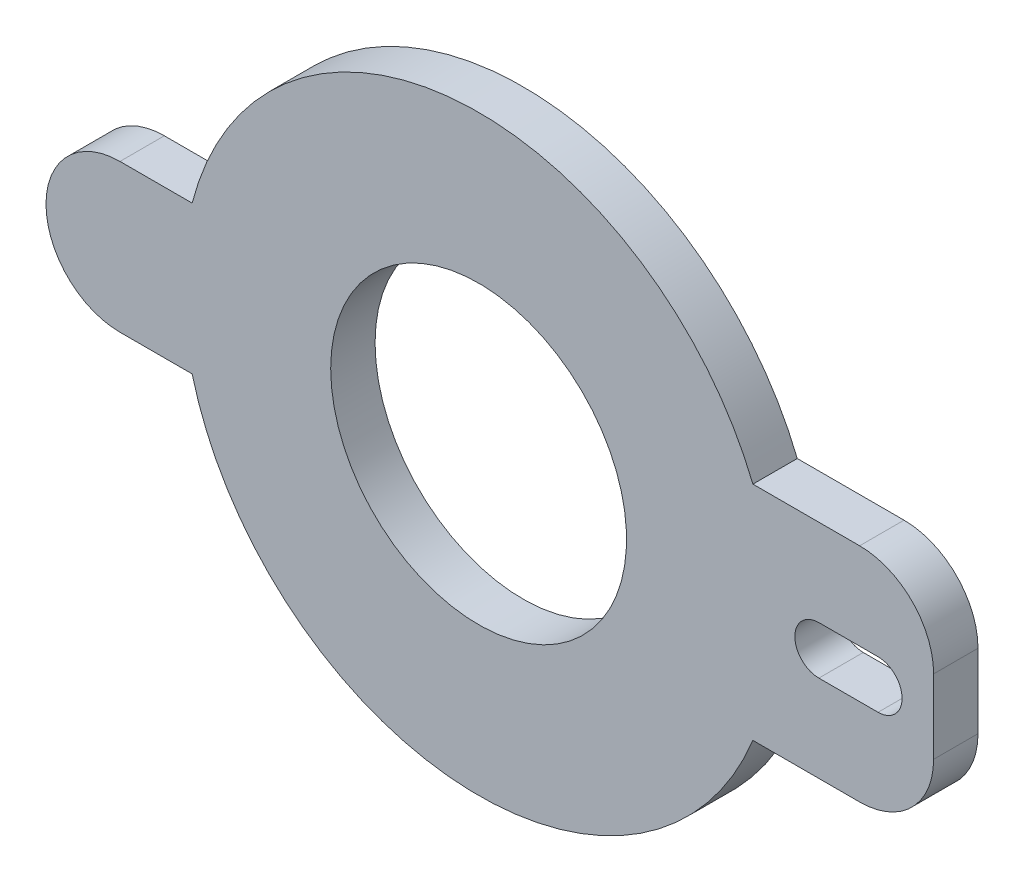
from build123d import *

# Parameters (mm, degrees)
SKETCH1_R           = 20
BOSS_EXTRUDE1_DEPTH = 6


with BuildPart() as part:
    # Sketch1 → Boss-Extrude1 (new body)
    with BuildSketch(Plane.XY.offset(6)):
        with BuildLine():
            Line((-91.761844853, 17.703382647), (-101.518898091, 17.703382647))
            ThreePointArc((-101.518898091, 17.703382647), (-111.518898091, 7.703382647), (-101.518898091, -2.296617353))
            Line((-101.518898091, -2.296617353), (-91.761844853, -2.296617353))
            ThreePointArc((-91.761844853, -2.296617353), (-55.664437873, -32.209902495), (-15.951018956, -7.296617353))
            Line((-15.951018956, -7.296617353), (-1.518898091, -7.296617353))
            ThreePointArc((-1.518898091, -7.296617353), (5.552169721, -4.367685165), (8.481101909, 2.703382647))
            Line((8.481101909, 2.703382647), (8.481101909, 12.703382647))
            ThreePointArc((8.481101909, 12.703382647), (5.552169721, 19.774450459), (-1.518898091, 22.703382647))
            Line((-1.518898091, 22.703382647), (-15.951018956, 22.703382647))
            ThreePointArc((-15.951018956, 22.703382647), (-55.664437873, 47.616667789), (-91.761844853, 17.703382647))
        make_face()
        with Locations(Location((-53.032011391, 7.703382647, 0), (0, 0, 180))):
            Circle(SKETCH1_R, mode=Mode.SUBTRACT)
        with BuildLine():
            Line((-7.032011391, 10.953382647), (0.967988609, 10.953382647))
            ThreePointArc((0.967988609, 10.953382647), (4.217988609, 7.703382647), (0.967988609, 4.453382647))
            Line((0.967988609, 4.453382647), (-7.032011391, 4.453382647))
            ThreePointArc((-7.032011391, 4.453382647), (-10.282011391, 7.703382647), (-7.032011391, 10.953382647))
        make_face(mode=Mode.SUBTRACT)
    extrude(amount=-BOSS_EXTRUDE1_DEPTH)


solid = part.part
